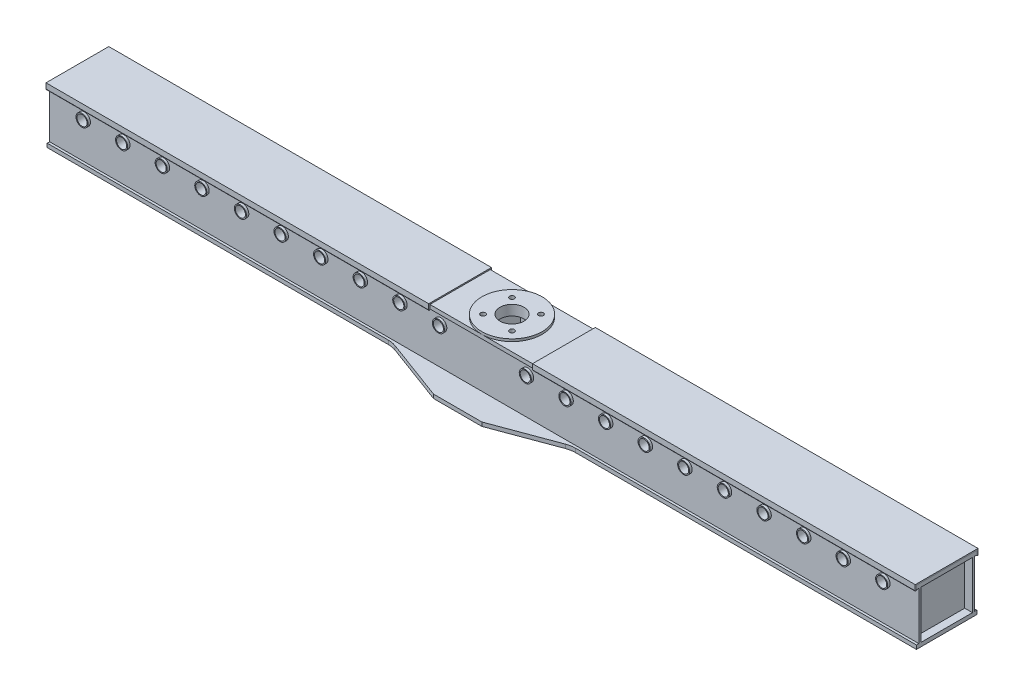
from build123d import *

# Parameters (mm, degrees)
SKETCH_1_R                  = 50
EXTRUDE_1_DEPTH             = 16
SKETCH_2_W                  = 3600
SKETCH_2_H                  = 250
SKETCH_2_R                  = 50
SKETCH_2_R_2                = 10
EXTRUDE_2_DEPTH             = 214
SKETCH_3_W                  = 250
SKETCH_3_H                  = 198
CUT_EXTRUDE_1_DEPTH         = 3615.349872384
SKETCH_6_W                  = 6
SKETCH_6_H                  = 214
EXTRUDE_4_DEPTH             = 198
PATTERN_LINEAR_2_COUNT      = 2
PATTERN_LINEAR_2_PITCH      = 150
PATTERN_LINEAR_3_COUNT      = 2
PATTERN_LINEAR_3_PITCH      = 310
PATTERN_LINEAR_4_COUNT      = 2
PATTERN_LINEAR_4_PITCH      = 500
PATTERN_LINEAR_5_COUNT      = 2
PATTERN_LINEAR_5_PITCH      = 678
PATTERN_LINEAR_6_COUNT      = 2
PATTERN_LINEAR_6_PITCH      = 855
PATTERN_LINEAR_7_COUNT      = 2
PATTERN_LINEAR_7_PITCH      = 1055
PATTERN_LINEAR_8_COUNT      = 2
PATTERN_LINEAR_8_PITCH      = 1290
PATTERN_LINEAR_9_COUNT      = 2
PATTERN_LINEAR_9_PITCH      = 1490
PATTERN_LINEAR_10_COUNT     = 2
PATTERN_LINEAR_10_PITCH     = 1690
MIRROR_2_COPY_1_SKETCH_W    = 6
MIRROR_2_COPY_1_SKETCH_H    = 214
MIRROR_2_COPY_1_DEPTH       = 198
MIRROR_2_COPY_2_SKETCH_W    = 6
MIRROR_2_COPY_2_SKETCH_H    = 214
MIRROR_2_COPY_2_DEPTH       = 198
MIRROR_2_COPY_3_SKETCH_W    = 6
MIRROR_2_COPY_3_SKETCH_H    = 214
MIRROR_2_COPY_3_DEPTH       = 198
MIRROR_2_COPY_4_SKETCH_W    = 6
MIRROR_2_COPY_4_SKETCH_H    = 214
MIRROR_2_COPY_4_DEPTH       = 198
MIRROR_2_COPY_5_SKETCH_W    = 6
MIRROR_2_COPY_5_SKETCH_H    = 214
MIRROR_2_COPY_5_DEPTH       = 198
MIRROR_2_COPY_6_SKETCH_W    = 6
MIRROR_2_COPY_6_SKETCH_H    = 214
MIRROR_2_COPY_6_DEPTH       = 198
MIRROR_2_COPY_7_SKETCH_W    = 6
MIRROR_2_COPY_7_SKETCH_H    = 214
MIRROR_2_COPY_7_DEPTH       = 198
MIRROR_2_COPY_8_SKETCH_W    = 6
MIRROR_2_COPY_8_SKETCH_H    = 214
MIRROR_2_COPY_8_DEPTH       = 198
MIRROR_2_COPY_9_SKETCH_W    = 6
MIRROR_2_COPY_9_SKETCH_H    = 214
MIRROR_2_COPY_9_DEPTH       = 198
SKETCH_7_R                  = 50
SKETCH_7_R_2                = 10
EXTRUDE_5_DEPTH             = 16
SKETCH_8_W                  = 7
SKETCH_8_H                  = 16
CUT_EXTRUDE_3_DEPTH         = 444
SKETCH_4_W                  = 8
SKETCH_4_H                  = 198
EXTRUDE_3_DEPTH             = 3600
SKETCH_5_R                  = 25
CUT_EXTRUDE_2_DEPTH         = 1847.212338817
SKETCH_11_R                 = 25
SKETCH_11_R_2               = 21
EXTRUDE_7_DEPTH             = 250
PATTERN_LINEAR_1_COUNT      = 10
PATTERN_LINEAR_1_PITCH      = 164
MIRROR_1_COPY_1_SKETCH_R    = 25
MIRROR_1_COPY_1_DEPTH       = 1847.212338817
MIRROR_1_COPY_2_SKETCH_R    = 25
MIRROR_1_COPY_2_DEPTH       = 1847.212338817
MIRROR_1_COPY_3_SKETCH_R    = 25
MIRROR_1_COPY_3_DEPTH       = 1847.212338817
MIRROR_1_COPY_4_SKETCH_R    = 25
MIRROR_1_COPY_4_DEPTH       = 1847.212338817
MIRROR_1_COPY_5_SKETCH_R    = 25
MIRROR_1_COPY_5_DEPTH       = 1847.212338817
MIRROR_1_COPY_6_SKETCH_R    = 25
MIRROR_1_COPY_6_DEPTH       = 1847.212338817
MIRROR_1_COPY_7_SKETCH_R    = 25
MIRROR_1_COPY_7_DEPTH       = 1847.212338817
MIRROR_1_COPY_8_SKETCH_R    = 25
MIRROR_1_COPY_8_DEPTH       = 1847.212338817
MIRROR_1_COPY_9_SKETCH_R    = 25
MIRROR_1_COPY_9_DEPTH       = 1847.212338817
MIRROR_1_COPY_10_SKETCH_R   = 25
MIRROR_1_COPY_10_SKETCH_R_2 = 21
MIRROR_1_COPY_10_DEPTH      = 250
MIRROR_1_COPY_11_SKETCH_R   = 25
MIRROR_1_COPY_11_SKETCH_R_2 = 21
MIRROR_1_COPY_11_DEPTH      = 250
MIRROR_1_COPY_12_SKETCH_R   = 25
MIRROR_1_COPY_12_SKETCH_R_2 = 21
MIRROR_1_COPY_12_DEPTH      = 250
MIRROR_1_COPY_13_SKETCH_R   = 25
MIRROR_1_COPY_13_SKETCH_R_2 = 21
MIRROR_1_COPY_13_DEPTH      = 250
MIRROR_1_COPY_14_SKETCH_R   = 25
MIRROR_1_COPY_14_SKETCH_R_2 = 21
MIRROR_1_COPY_14_DEPTH      = 250
MIRROR_1_COPY_15_SKETCH_R   = 25
MIRROR_1_COPY_15_SKETCH_R_2 = 21
MIRROR_1_COPY_15_DEPTH      = 250
MIRROR_1_COPY_16_SKETCH_R   = 25
MIRROR_1_COPY_16_SKETCH_R_2 = 21
MIRROR_1_COPY_16_DEPTH      = 250
MIRROR_1_COPY_17_SKETCH_R   = 25
MIRROR_1_COPY_17_SKETCH_R_2 = 21
MIRROR_1_COPY_17_DEPTH      = 250
MIRROR_1_COPY_18_SKETCH_R   = 25
MIRROR_1_COPY_18_SKETCH_R_2 = 21
MIRROR_1_COPY_18_DEPTH      = 250
SKETCH_9_R                  = 125
SKETCH_9_R_2                = 50
SKETCH_9_R_3                = 10
EXTRUDE_6_DEPTH             = 10
EXTRUDE_8_DEPTH             = 1585
EXTRUDE_9_DEPTH             = 1585
SKETCH_14_W                 = 250
SKETCH_14_H                 = 240
EXTRUDE_10_DEPTH            = 5


with BuildPart() as part:
    # 草图1 → 凸台-拉伸1 (new body)
    with BuildSketch(Plane(origin=(0, 0, 0), x_dir=(1, 0, 0), z_dir=(0, 1, 0))):
        with BuildLine():
            Line((-1800, -125), (-1800, 125))
            Line((-1800, 125), (-387.454779052, 125))
            ThreePointArc((-387.454779052, 125), (-369.782593287, 126.573916819), (-352.666698531, 131.246122994))
            Line((-352.666698531, 131.246122994), (-100, 225))
            Line((-100, 225), (100, 225))
            Line((100, 225), (352.666698531, 131.246122994))
            ThreePointArc((352.666698531, 131.246122994), (369.782593287, 126.573916819), (387.454779052, 125))
            Line((387.454779052, 125), (1800, 125))
            Line((1800, 125), (1800, -125))
            Line((1800, -125), (387.454779052, -125))
            ThreePointArc((387.454779052, -125), (369.782593287, -126.573916819), (352.666698531, -131.246122994))
            Line((352.666698531, -131.246122994), (100, -225))
            Line((100, -225), (-100, -225))
            Line((-100, -225), (-352.666698531, -131.246122994))
            ThreePointArc((-352.666698531, -131.246122994), (-369.782593287, -126.573916819), (-387.454779052, -125))
            Line((-387.454779052, -125), (-1800, -125))
        make_face()
        with Locations(Location((0, 0, 0), (0, 0, 270))):
            Circle(SKETCH_1_R, mode=Mode.SUBTRACT)
    extrude(amount=EXTRUDE_1_DEPTH)

    # 草图2 → 凸台-拉伸2 (add)
    with BuildSketch(Plane(origin=(0, 16, 0), x_dir=(-1, 0, 0), z_dir=(0, -1, 0))):
        Rectangle(SKETCH_2_W, SKETCH_2_H)
        with Locations(Location((0, 0, 0), (0, 0, 90))):
            Circle(SKETCH_2_R, mode=Mode.SUBTRACT)
        with Locations(Location((60, -60, 0), (0, 0, 90))):
            Circle(SKETCH_2_R_2, mode=Mode.SUBTRACT)
        with Locations(Location((-60, -60, 0), (0, 0, 90))):
            Circle(SKETCH_2_R_2, mode=Mode.SUBTRACT)
        with Locations(Location((60, 60, 0), (0, 0, 90))):
            Circle(SKETCH_2_R_2, mode=Mode.SUBTRACT)
        with Locations(Location((-60, 60, 0), (0, 0, 90))):
            Circle(SKETCH_2_R_2, mode=Mode.SUBTRACT)
    extrude(amount=-EXTRUDE_2_DEPTH)

    # 草图3 → 切除-拉伸1 (cut, through all)
    with BuildSketch(Plane(origin=(1800, 0, 0), x_dir=(0, 0, -1), z_dir=(1, 0, 0))):
        with Locations((0, 115)):
            Rectangle(SKETCH_3_W, SKETCH_3_H)
    extrude(amount=-CUT_EXTRUDE_1_DEPTH, mode=Mode.SUBTRACT)


with BuildPart() as cut_extrude_1_piece_1:
    # of the separate pieces the step leaves, piece 1, a body of its own (cut_extrude_1_pieces)
    add(part.part.solids().sort_by_distance((-1800, 0, 125))[0])



with BuildPart() as cut_extrude_1_piece_2:
    # of the separate pieces the step leaves, piece 2, a body of its own (cut_extrude_1_pieces)
    add(part.part.solids().sort_by_distance((-1800, 214, -125))[0])


with BuildPart() as cut_extrude_1_piece_1_1:
    add(cut_extrude_1_piece_1.part)

    add(cut_extrude_1_piece_2.part)  # 凸台-拉伸4 merges 切除-拉伸1 piece 2
    # 草图6 → 凸台-拉伸4 (add)
    with BuildSketch(Plane.XZ.offset(-214)):
        with Locations((75, 0)):
            Rectangle(SKETCH_6_W, SKETCH_6_H)
    extrude_4 = extrude(amount=EXTRUDE_4_DEPTH)

    # 阵列(线性)2: 凸台-拉伸4 ×2
    with Locations(*[(i * PATTERN_LINEAR_2_PITCH, 0, 0) for i in range(1, PATTERN_LINEAR_2_COUNT)]):
        add(extrude_4)

    # 阵列(线性)3: 凸台-拉伸4 ×2
    with Locations(*[(i * PATTERN_LINEAR_3_PITCH, 0, 0) for i in range(1, PATTERN_LINEAR_3_COUNT)]):
        add(extrude_4)

    # 阵列(线性)4: 凸台-拉伸4 ×2
    with Locations(*[(i * PATTERN_LINEAR_4_PITCH, 0, 0) for i in range(1, PATTERN_LINEAR_4_COUNT)]):
        add(extrude_4)

    # 阵列(线性)5: 凸台-拉伸4 ×2
    with Locations(*[(i * PATTERN_LINEAR_5_PITCH, 0, 0) for i in range(1, PATTERN_LINEAR_5_COUNT)]):
        add(extrude_4)

    # 阵列(线性)6: 凸台-拉伸4 ×2
    with Locations(*[(i * PATTERN_LINEAR_6_PITCH, 0, 0) for i in range(1, PATTERN_LINEAR_6_COUNT)]):
        add(extrude_4)

    # 阵列(线性)7: 凸台-拉伸4 ×2
    with Locations(*[(i * PATTERN_LINEAR_7_PITCH, 0, 0) for i in range(1, PATTERN_LINEAR_7_COUNT)]):
        add(extrude_4)

    # 阵列(线性)8: 凸台-拉伸4 ×2
    with Locations(*[(i * PATTERN_LINEAR_8_PITCH, 0, 0) for i in range(1, PATTERN_LINEAR_8_COUNT)]):
        add(extrude_4)

    # 阵列(线性)9: 凸台-拉伸4 ×2
    with Locations(*[(i * PATTERN_LINEAR_9_PITCH, 0, 0) for i in range(1, PATTERN_LINEAR_9_COUNT)]):
        add(extrude_4)

    # 阵列(线性)10: 凸台-拉伸4 ×2
    with Locations(*[(i * PATTERN_LINEAR_10_PITCH, 0, 0) for i in range(1, PATTERN_LINEAR_10_COUNT)]):
        add(extrude_4)

    # 镜向2: 凸台-拉伸4 across plane
    add(extrude_4.mirror(Plane(origin=(0, 0, 0), x_dir=(0, 0, 1), z_dir=(1, 0, 0))))

    # 镜向2 copy 1 sketch → 镜向2 copy 1 (add)
    with BuildSketch(Plane(origin=(-150, 214, 0), x_dir=(-1, 0, 0), z_dir=(0, -1, 0))):
        with Locations((75, 0)):
            Rectangle(MIRROR_2_COPY_1_SKETCH_W, MIRROR_2_COPY_1_SKETCH_H)
    extrude(amount=MIRROR_2_COPY_1_DEPTH)

    # 镜向2 copy 2 sketch → 镜向2 copy 2 (add)
    with BuildSketch(Plane(origin=(-310, 214, 0), x_dir=(-1, 0, 0), z_dir=(0, -1, 0))):
        with Locations((75, 0)):
            Rectangle(MIRROR_2_COPY_2_SKETCH_W, MIRROR_2_COPY_2_SKETCH_H)
    extrude(amount=MIRROR_2_COPY_2_DEPTH)

    # 镜向2 copy 3 sketch → 镜向2 copy 3 (add)
    with BuildSketch(Plane(origin=(-500, 214, 0), x_dir=(-1, 0, 0), z_dir=(0, -1, 0))):
        with Locations((75, 0)):
            Rectangle(MIRROR_2_COPY_3_SKETCH_W, MIRROR_2_COPY_3_SKETCH_H)
    extrude(amount=MIRROR_2_COPY_3_DEPTH)

    # 镜向2 copy 4 sketch → 镜向2 copy 4 (add)
    with BuildSketch(Plane(origin=(-678, 214, 0), x_dir=(-1, 0, 0), z_dir=(0, -1, 0))):
        with Locations((75, 0)):
            Rectangle(MIRROR_2_COPY_4_SKETCH_W, MIRROR_2_COPY_4_SKETCH_H)
    extrude(amount=MIRROR_2_COPY_4_DEPTH)

    # 镜向2 copy 5 sketch → 镜向2 copy 5 (add)
    with BuildSketch(Plane(origin=(-855, 214, 0), x_dir=(-1, 0, 0), z_dir=(0, -1, 0))):
        with Locations((75, 0)):
            Rectangle(MIRROR_2_COPY_5_SKETCH_W, MIRROR_2_COPY_5_SKETCH_H)
    extrude(amount=MIRROR_2_COPY_5_DEPTH)

    # 镜向2 copy 6 sketch → 镜向2 copy 6 (add)
    with BuildSketch(Plane(origin=(-1055, 214, 0), x_dir=(-1, 0, 0), z_dir=(0, -1, 0))):
        with Locations((75, 0)):
            Rectangle(MIRROR_2_COPY_6_SKETCH_W, MIRROR_2_COPY_6_SKETCH_H)
    extrude(amount=MIRROR_2_COPY_6_DEPTH)

    # 镜向2 copy 7 sketch → 镜向2 copy 7 (add)
    with BuildSketch(Plane(origin=(-1290, 214, 0), x_dir=(-1, 0, 0), z_dir=(0, -1, 0))):
        with Locations((75, 0)):
            Rectangle(MIRROR_2_COPY_7_SKETCH_W, MIRROR_2_COPY_7_SKETCH_H)
    extrude(amount=MIRROR_2_COPY_7_DEPTH)

    # 镜向2 copy 8 sketch → 镜向2 copy 8 (add)
    with BuildSketch(Plane(origin=(-1490, 214, 0), x_dir=(-1, 0, 0), z_dir=(0, -1, 0))):
        with Locations((75, 0)):
            Rectangle(MIRROR_2_COPY_8_SKETCH_W, MIRROR_2_COPY_8_SKETCH_H)
    extrude(amount=MIRROR_2_COPY_8_DEPTH)

    # 镜向2 copy 9 sketch → 镜向2 copy 9 (add)
    with BuildSketch(Plane(origin=(-1690, 214, 0), x_dir=(-1, 0, 0), z_dir=(0, -1, 0))):
        with Locations((75, 0)):
            Rectangle(MIRROR_2_COPY_9_SKETCH_W, MIRROR_2_COPY_9_SKETCH_H)
    extrude(amount=MIRROR_2_COPY_9_DEPTH)

    # 草图7 → 凸台-拉伸5 (add)
    with BuildSketch(Plane.XZ.offset(-214)):
        Polygon((-370, 10), (-370, -10), (-228, -100), (228, -100), (370, -10), (370, 10), (228, 100), (-228, 100), align=None)
        with Locations(Location((0, 0, 0), (0, 0, 270))):
            Circle(SKETCH_7_R, mode=Mode.SUBTRACT)
        with Locations(Location((-60, 60, 0), (0, 0, 270))):
            Circle(SKETCH_7_R_2, mode=Mode.SUBTRACT)
        with Locations(Location((60, 60, 0), (0, 0, 270))):
            Circle(SKETCH_7_R_2, mode=Mode.SUBTRACT)
        with Locations(Location((60, -60, 0), (0, 0, 270))):
            Circle(SKETCH_7_R_2, mode=Mode.SUBTRACT)
        with Locations(Location((-60, -60, 0), (0, 0, 270))):
            Circle(SKETCH_7_R_2, mode=Mode.SUBTRACT)
    extrude(amount=EXTRUDE_5_DEPTH)

    # 草图8 → 切除-拉伸3 (cut)
    with BuildSketch(Plane(origin=(228, 0, 0), x_dir=(0, 0, -1), z_dir=(1, 0, 0))):
        with Locations((-103.5, 206)):
            Rectangle(SKETCH_8_W, SKETCH_8_H)
        with Locations((103.5, 206)):
            Rectangle(SKETCH_8_W, SKETCH_8_H)
    extrude(amount=-CUT_EXTRUDE_3_DEPTH, mode=Mode.SUBTRACT)

    # 草图4 → 凸台-拉伸3 (add)
    with BuildSketch(Plane(origin=(1800, 0, 0), x_dir=(0, 0, -1), z_dir=(1, 0, 0))):
        with Locations((-111, 115)):
            Rectangle(SKETCH_4_W, SKETCH_4_H)
        with Locations((111, 115)):
            Rectangle(SKETCH_4_W, SKETCH_4_H)
    extrude(amount=-EXTRUDE_3_DEPTH)

    # 草图5 → 切除-拉伸2 (cut, through all)
    with BuildSketch(Plane.XY.offset(115)):
        with Locations(Location((-180, 170, 0), (0, 0, 270))):
            Circle(SKETCH_5_R)
    cut_extrude_2 = extrude(amount=-CUT_EXTRUDE_2_DEPTH, mode=Mode.SUBTRACT)

    # 草图11 → 凸台-拉伸7 (add)
    with BuildSketch(Plane.XY.offset(125)):
        with Locations((-180, 170)):
            Circle(SKETCH_11_R)
        with Locations((-180, 170)):
            Circle(SKETCH_11_R_2, mode=Mode.SUBTRACT)
    extrude_7 = extrude(amount=-EXTRUDE_7_DEPTH)

    # 阵列(线性)1: 切除-拉伸2, 凸台-拉伸7 ×10
    with Locations(*[(-i * PATTERN_LINEAR_1_PITCH, 0, 0) for i in range(1, PATTERN_LINEAR_1_COUNT)]):
        add(cut_extrude_2, mode=Mode.SUBTRACT)
        add(extrude_7)

    # 镜向1: 切除-拉伸2, 凸台-拉伸7 across plane
    add(cut_extrude_2.mirror(Plane(origin=(0, 0, 0), x_dir=(0, 0, 1), z_dir=(1, 0, 0))), mode=Mode.SUBTRACT)
    add(extrude_7.mirror(Plane(origin=(0, 0, 0), x_dir=(0, 0, 1), z_dir=(1, 0, 0))))

    # 镜向1 copy 1 sketch → 镜向1 copy 1 (cut, through all)
    with BuildSketch(Plane(origin=(164, 0, 115), x_dir=(-1, 0, 0), z_dir=(0, 0, 1))):
        with Locations((-180, -170)):
            Circle(MIRROR_1_COPY_1_SKETCH_R)
    extrude(amount=-MIRROR_1_COPY_1_DEPTH, mode=Mode.SUBTRACT)

    # 镜向1 copy 2 sketch → 镜向1 copy 2 (cut, through all)
    with BuildSketch(Plane(origin=(328, 0, 115), x_dir=(-1, 0, 0), z_dir=(0, 0, 1))):
        with Locations((-180, -170)):
            Circle(MIRROR_1_COPY_2_SKETCH_R)
    extrude(amount=-MIRROR_1_COPY_2_DEPTH, mode=Mode.SUBTRACT)

    # 镜向1 copy 3 sketch → 镜向1 copy 3 (cut, through all)
    with BuildSketch(Plane(origin=(492, 0, 115), x_dir=(-1, 0, 0), z_dir=(0, 0, 1))):
        with Locations((-180, -170)):
            Circle(MIRROR_1_COPY_3_SKETCH_R)
    extrude(amount=-MIRROR_1_COPY_3_DEPTH, mode=Mode.SUBTRACT)

    # 镜向1 copy 4 sketch → 镜向1 copy 4 (cut, through all)
    with BuildSketch(Plane(origin=(656, 0, 115), x_dir=(-1, 0, 0), z_dir=(0, 0, 1))):
        with Locations((-180, -170)):
            Circle(MIRROR_1_COPY_4_SKETCH_R)
    extrude(amount=-MIRROR_1_COPY_4_DEPTH, mode=Mode.SUBTRACT)

    # 镜向1 copy 5 sketch → 镜向1 copy 5 (cut, through all)
    with BuildSketch(Plane(origin=(820, 0, 115), x_dir=(-1, 0, 0), z_dir=(0, 0, 1))):
        with Locations((-180, -170)):
            Circle(MIRROR_1_COPY_5_SKETCH_R)
    extrude(amount=-MIRROR_1_COPY_5_DEPTH, mode=Mode.SUBTRACT)

    # 镜向1 copy 6 sketch → 镜向1 copy 6 (cut, through all)
    with BuildSketch(Plane(origin=(984, 0, 115), x_dir=(-1, 0, 0), z_dir=(0, 0, 1))):
        with Locations((-180, -170)):
            Circle(MIRROR_1_COPY_6_SKETCH_R)
    extrude(amount=-MIRROR_1_COPY_6_DEPTH, mode=Mode.SUBTRACT)

    # 镜向1 copy 7 sketch → 镜向1 copy 7 (cut, through all)
    with BuildSketch(Plane(origin=(1148, 0, 115), x_dir=(-1, 0, 0), z_dir=(0, 0, 1))):
        with Locations((-180, -170)):
            Circle(MIRROR_1_COPY_7_SKETCH_R)
    extrude(amount=-MIRROR_1_COPY_7_DEPTH, mode=Mode.SUBTRACT)

    # 镜向1 copy 8 sketch → 镜向1 copy 8 (cut, through all)
    with BuildSketch(Plane(origin=(1312, 0, 115), x_dir=(-1, 0, 0), z_dir=(0, 0, 1))):
        with Locations((-180, -170)):
            Circle(MIRROR_1_COPY_8_SKETCH_R)
    extrude(amount=-MIRROR_1_COPY_8_DEPTH, mode=Mode.SUBTRACT)

    # 镜向1 copy 9 sketch → 镜向1 copy 9 (cut, through all)
    with BuildSketch(Plane(origin=(1476, 0, 115), x_dir=(-1, 0, 0), z_dir=(0, 0, 1))):
        with Locations((-180, -170)):
            Circle(MIRROR_1_COPY_9_SKETCH_R)
    extrude(amount=-MIRROR_1_COPY_9_DEPTH, mode=Mode.SUBTRACT)

    # 镜向1 copy 10 sketch → 镜向1 copy 10 (add)
    with BuildSketch(Plane(origin=(164, 0, 125), x_dir=(-1, 0, 0), z_dir=(0, 0, 1))):
        with Locations((-180, -170)):
            Circle(MIRROR_1_COPY_10_SKETCH_R)
        with Locations((-180, -170)):
            Circle(MIRROR_1_COPY_10_SKETCH_R_2, mode=Mode.SUBTRACT)
    extrude(amount=-MIRROR_1_COPY_10_DEPTH)

    # 镜向1 copy 11 sketch → 镜向1 copy 11 (add)
    with BuildSketch(Plane(origin=(328, 0, 125), x_dir=(-1, 0, 0), z_dir=(0, 0, 1))):
        with Locations((-180, -170)):
            Circle(MIRROR_1_COPY_11_SKETCH_R)
        with Locations((-180, -170)):
            Circle(MIRROR_1_COPY_11_SKETCH_R_2, mode=Mode.SUBTRACT)
    extrude(amount=-MIRROR_1_COPY_11_DEPTH)

    # 镜向1 copy 12 sketch → 镜向1 copy 12 (add)
    with BuildSketch(Plane(origin=(492, 0, 125), x_dir=(-1, 0, 0), z_dir=(0, 0, 1))):
        with Locations((-180, -170)):
            Circle(MIRROR_1_COPY_12_SKETCH_R)
        with Locations((-180, -170)):
            Circle(MIRROR_1_COPY_12_SKETCH_R_2, mode=Mode.SUBTRACT)
    extrude(amount=-MIRROR_1_COPY_12_DEPTH)

    # 镜向1 copy 13 sketch → 镜向1 copy 13 (add)
    with BuildSketch(Plane(origin=(656, 0, 125), x_dir=(-1, 0, 0), z_dir=(0, 0, 1))):
        with Locations((-180, -170)):
            Circle(MIRROR_1_COPY_13_SKETCH_R)
        with Locations((-180, -170)):
            Circle(MIRROR_1_COPY_13_SKETCH_R_2, mode=Mode.SUBTRACT)
    extrude(amount=-MIRROR_1_COPY_13_DEPTH)

    # 镜向1 copy 14 sketch → 镜向1 copy 14 (add)
    with BuildSketch(Plane(origin=(820, 0, 125), x_dir=(-1, 0, 0), z_dir=(0, 0, 1))):
        with Locations((-180, -170)):
            Circle(MIRROR_1_COPY_14_SKETCH_R)
        with Locations((-180, -170)):
            Circle(MIRROR_1_COPY_14_SKETCH_R_2, mode=Mode.SUBTRACT)
    extrude(amount=-MIRROR_1_COPY_14_DEPTH)

    # 镜向1 copy 15 sketch → 镜向1 copy 15 (add)
    with BuildSketch(Plane(origin=(984, 0, 125), x_dir=(-1, 0, 0), z_dir=(0, 0, 1))):
        with Locations((-180, -170)):
            Circle(MIRROR_1_COPY_15_SKETCH_R)
        with Locations((-180, -170)):
            Circle(MIRROR_1_COPY_15_SKETCH_R_2, mode=Mode.SUBTRACT)
    extrude(amount=-MIRROR_1_COPY_15_DEPTH)

    # 镜向1 copy 16 sketch → 镜向1 copy 16 (add)
    with BuildSketch(Plane(origin=(1148, 0, 125), x_dir=(-1, 0, 0), z_dir=(0, 0, 1))):
        with Locations((-180, -170)):
            Circle(MIRROR_1_COPY_16_SKETCH_R)
        with Locations((-180, -170)):
            Circle(MIRROR_1_COPY_16_SKETCH_R_2, mode=Mode.SUBTRACT)
    extrude(amount=-MIRROR_1_COPY_16_DEPTH)

    # 镜向1 copy 17 sketch → 镜向1 copy 17 (add)
    with BuildSketch(Plane(origin=(1312, 0, 125), x_dir=(-1, 0, 0), z_dir=(0, 0, 1))):
        with Locations((-180, -170)):
            Circle(MIRROR_1_COPY_17_SKETCH_R)
        with Locations((-180, -170)):
            Circle(MIRROR_1_COPY_17_SKETCH_R_2, mode=Mode.SUBTRACT)
    extrude(amount=-MIRROR_1_COPY_17_DEPTH)

    # 镜向1 copy 18 sketch → 镜向1 copy 18 (add)
    with BuildSketch(Plane(origin=(1476, 0, 125), x_dir=(-1, 0, 0), z_dir=(0, 0, 1))):
        with Locations((-180, -170)):
            Circle(MIRROR_1_COPY_18_SKETCH_R)
        with Locations((-180, -170)):
            Circle(MIRROR_1_COPY_18_SKETCH_R_2, mode=Mode.SUBTRACT)
    extrude(amount=-MIRROR_1_COPY_18_DEPTH)

    # 草图9 → 凸台-拉伸6 (add)
    with BuildSketch(Plane(origin=(0, 230, 0), x_dir=(1, 0, 0), z_dir=(0, 1, 0))):
        with Locations(Location((0, 0, 0), (0, 0, 270))):
            Circle(SKETCH_9_R)
        with Locations(Location((0, 0, 0), (0, 0, 90))):
            Circle(SKETCH_9_R_2, mode=Mode.SUBTRACT)
        with Locations(Location((-60, 60, 0), (0, 0, 90))):
            Circle(SKETCH_9_R_3, mode=Mode.SUBTRACT)
        with Locations(Location((60, 60, 0), (0, 0, 90))):
            Circle(SKETCH_9_R_3, mode=Mode.SUBTRACT)
        with Locations(Location((-60, -60, 0), (0, 0, 90))):
            Circle(SKETCH_9_R_3, mode=Mode.SUBTRACT)
        with Locations(Location((60, -60, 0), (0, 0, 90))):
            Circle(SKETCH_9_R_3, mode=Mode.SUBTRACT)
    extrude(amount=EXTRUDE_6_DEPTH)

    # 草图14 → 凸台-拉伸10 (add)
    with BuildSketch(Plane(origin=(0, 0, 0), x_dir=(-1, 0, 0), z_dir=(0, -1, 0))):
        with Locations((752.5, 0)):
            Rectangle(SKETCH_14_W, SKETCH_14_H)
        with Locations((-752.5, 0)):
            Rectangle(SKETCH_14_W, SKETCH_14_H)
    extrude(amount=EXTRUDE_10_DEPTH)


with BuildPart() as body_2:
    # 草图12 → 凸台-拉伸8 (new body)
    with BuildSketch(Plane(origin=(1800, 0, 0), x_dir=(0, 0, -1), z_dir=(1, 0, 0))):
        Polygon((-125, 214), (-125, 230), (125, 230), (125, 214), (124.133974596, 212.5), (128.464101615, 210), (130, 212.660254038), (130, 235), (-130, 235), (-130, 212.660254038), (-128.464101615, 210), (-124.133974596, 212.5), align=None)
    extrude(amount=-EXTRUDE_8_DEPTH)


with BuildPart() as body_3:
    # 草图13 → 凸台-拉伸9 (new body)
    with BuildSketch(Plane.ZY.offset(1800)):
        Polygon((-125, 214), (-125, 230), (125, 230), (125, 214), (124.133974596, 212.5), (128.464101615, 210), (130, 212.660254038), (130, 235), (-130, 235), (-130, 212.660254038), (-128.464101615, 210), (-124.133974596, 212.5), align=None)
    extrude(amount=-EXTRUDE_9_DEPTH)


solid = Compound([cut_extrude_1_piece_1_1.part, body_2.part, body_3.part])
